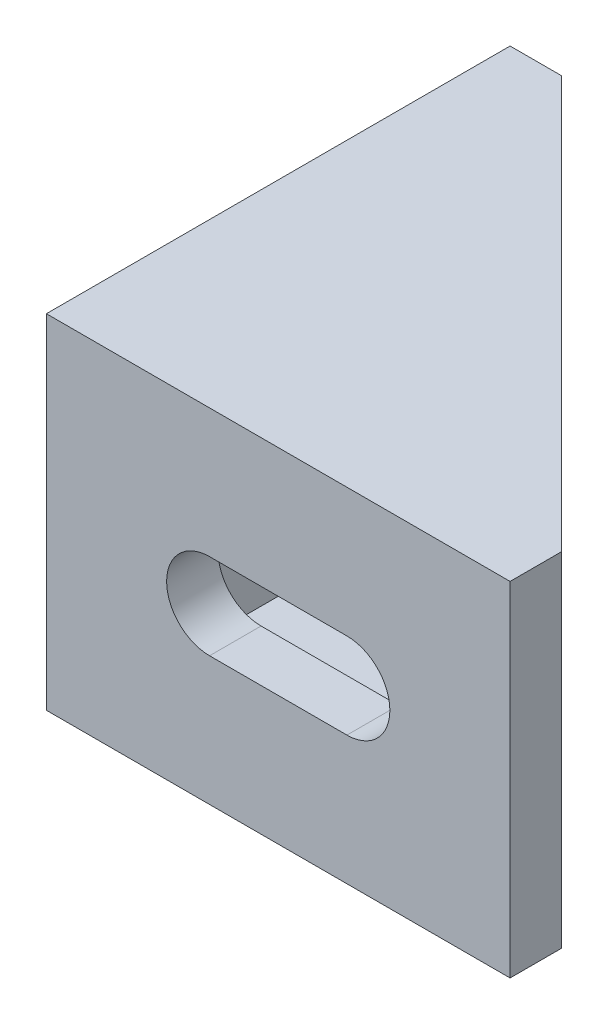
from build123d import *

# Parameters (mm, degrees)
SKETCH1_W           = 27
SKETCH1_H           = 20
BOSS_EXTRUDE1_DEPTH = 3
SKETCH2_W           = 3
SKETCH2_H           = 20
BOSS_EXTRUDE2_DEPTH = 24
BOSS_EXTRUDE3_DEPTH = 2
CUT_EXTRUDE1_DEPTH  = 3


with BuildPart() as part:
    # Sketch1 → Boss-Extrude1 (new body)
    with BuildSketch(Plane.XY):
        Rectangle(SKETCH1_W, SKETCH1_H)
        with BuildLine():
            Line((4, -2.5), (-4, -2.5))
            ThreePointArc((-4, -2.5), (-6.5, 0), (-4, 2.5))
            Line((-4, 2.5), (4, 2.5))
            ThreePointArc((4, 2.5), (6.5, 0), (4, -2.5))
        make_face(mode=Mode.SUBTRACT)
    extrude(amount=BOSS_EXTRUDE1_DEPTH)

    # Sketch2 → Boss-Extrude2 (add)
    with BuildSketch(Plane(origin=(0, 0, 0), x_dir=(-1, 0, 0), z_dir=(0, 0, -1))):
        with Locations((12, 0)):
            Rectangle(SKETCH2_W, SKETCH2_H)
    extrude(amount=BOSS_EXTRUDE2_DEPTH)

    # Sketch3 → Boss-Extrude3 (add)
    with BuildSketch(Plane.XZ.offset(10)):
        Polygon((-10.5, -24), (13.5, 0), (13.5, 3), (-13.5, 3), (-13.5, -24), align=None)
    boss_extrude3 = extrude(amount=-BOSS_EXTRUDE3_DEPTH)

    # Mirror1: Boss-Extrude3 across plane
    add(boss_extrude3.mirror(Plane.ZX))

    # Sketch4 → Cut-Extrude1 (cut)
    with BuildSketch(Plane(origin=(-10.5, 0, 0), x_dir=(0, 0, -1), z_dir=(1, 0, 0))):
        with BuildLine():
            Line((8, 2.5), (16, 2.5))
            ThreePointArc((16, 2.5), (18.5, 0), (16, -2.5))
            Line((16, -2.5), (8, -2.5))
            ThreePointArc((8, -2.5), (5.5, 0), (8, 2.5))
        make_face()
    extrude(amount=-CUT_EXTRUDE1_DEPTH, mode=Mode.SUBTRACT)


solid = part.part
